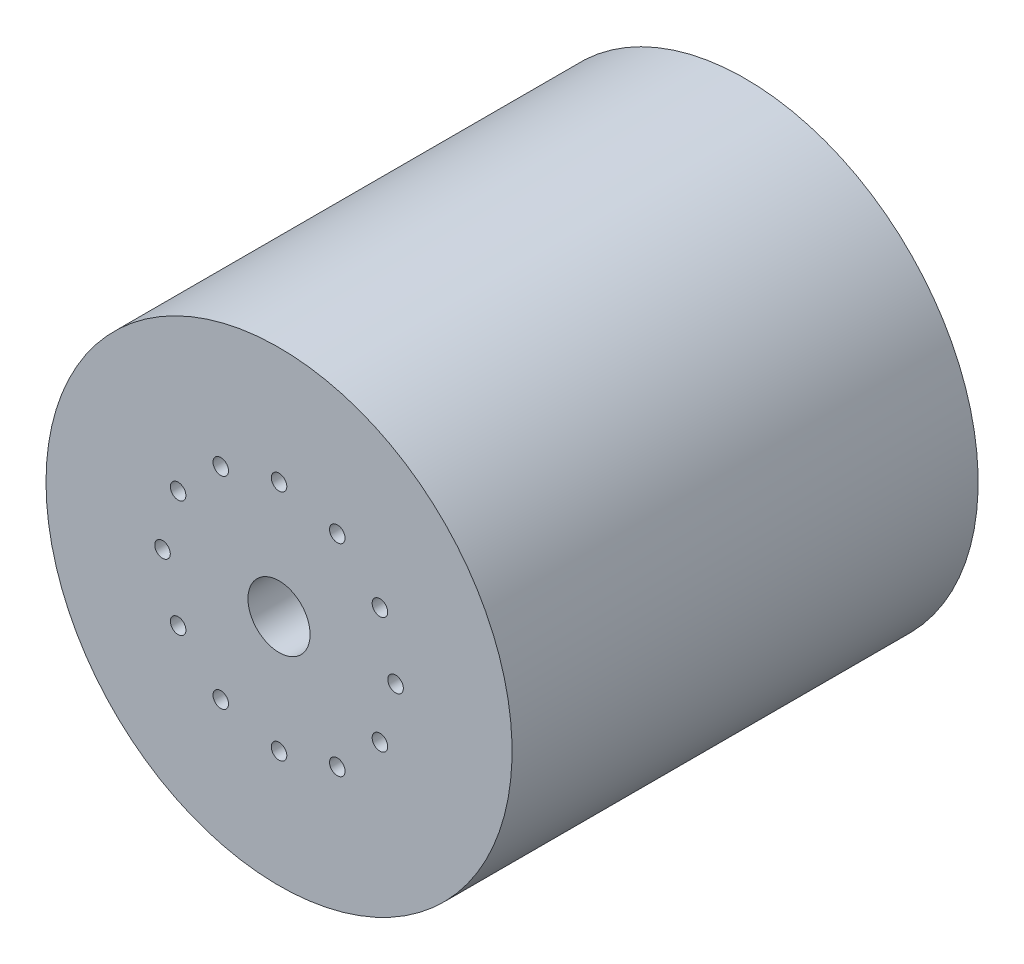
from build123d import *

# Parameters (mm, degrees)
SKETCH1_R           = 38.1
SKETCH1_R_2         = 35.56
SKETCH1_R_3         = 1.27
SKETCH1_R_4         = 7.62
SKETCH1_R_5         = 5.08
BOSS_EXTRUDE1_DEPTH = 76.2
SKETCH3_R           = 35.56
SKETCH3_R_2         = 7.62
SKETCH3_R_3         = 1.27
CUT_EXTRUDE1_DEPTH  = 73.66
SCALE3_SCALE        = 29
SCALE4_SCALE        = 0.95


with BuildPart() as part:
    # Sketch1 → Boss-Extrude1 (new body)
    # profile 1 of 3: a face of its own
    with BuildSketch(Plane.XY):
        with Locations(Location((0, 0, 0), (0, 0, 180))):
            Circle(SKETCH1_R)
        Circle(SKETCH1_R_2, mode=Mode.SUBTRACT)
    # profile 2 of 3: a face of its own
    with BuildSketch(Plane.XY):
        Circle(SKETCH1_R_2)
        with Locations(Location((-9.525, 16.497783942, 0), (0, 0, 180))):
            Circle(SKETCH1_R_3, mode=Mode.SUBTRACT)
        with Locations(Location((-16.497783942, 9.525, 0), (0, 0, 180))):
            Circle(SKETCH1_R_3, mode=Mode.SUBTRACT)
        with Locations(Location((-19.05, 0, 0), (0, 0, 180))):
            Circle(SKETCH1_R_3, mode=Mode.SUBTRACT)
        with Locations(Location((-16.497783942, -9.525, 0), (0, 0, 180))):
            Circle(SKETCH1_R_3, mode=Mode.SUBTRACT)
        with Locations(Location((-9.525, -16.497783942, 0), (0, 0, 180))):
            Circle(SKETCH1_R_3, mode=Mode.SUBTRACT)
        with Locations(Location((0, -19.05, 0), (0, 0, 180))):
            Circle(SKETCH1_R_3, mode=Mode.SUBTRACT)
        with Locations(Location((9.525, -16.497783942, 0), (0, 0, 180))):
            Circle(SKETCH1_R_3, mode=Mode.SUBTRACT)
        with Locations(Location((16.497783942, -9.525, 0), (0, 0, 180))):
            Circle(SKETCH1_R_3, mode=Mode.SUBTRACT)
        with Locations(Location((19.05, 0, 0), (0, 0, 180))):
            Circle(SKETCH1_R_3, mode=Mode.SUBTRACT)
        with Locations(Location((16.497783942, 9.525, 0), (0, 0, 180))):
            Circle(SKETCH1_R_3, mode=Mode.SUBTRACT)
        with Locations(Location((9.525, 16.497783942, 0), (0, 0, 180))):
            Circle(SKETCH1_R_3, mode=Mode.SUBTRACT)
        with Locations(Location((0, 19.05, 0), (0, 0, 180))):
            Circle(SKETCH1_R_3, mode=Mode.SUBTRACT)
        Circle(SKETCH1_R_4, mode=Mode.SUBTRACT)
    # profile 3 of 3: a face of its own
    with BuildSketch(Plane.XY):
        Circle(SKETCH1_R_4)
        with Locations(Location((0, 0, 0), (0, 0, 180))):
            Circle(SKETCH1_R_5, mode=Mode.SUBTRACT)
    extrude(amount=BOSS_EXTRUDE1_DEPTH)

    # Sketch3 → Cut-Extrude1 (cut)
    with BuildSketch(Plane(origin=(0, 0, 0), x_dir=(-1, 0, 0), z_dir=(0, 0, -1))):
        Circle(SKETCH3_R)
        Circle(SKETCH3_R_2, mode=Mode.SUBTRACT)
        with Locations((16.497783942, 9.525)):
            Circle(SKETCH3_R_3, mode=Mode.SUBTRACT)
        with Locations((16.497783942, -9.525)):
            Circle(SKETCH3_R_3, mode=Mode.SUBTRACT)
        with Locations((0, -19.05)):
            Circle(SKETCH3_R_3, mode=Mode.SUBTRACT)
        with Locations((-16.497783942, -9.525)):
            Circle(SKETCH3_R_3, mode=Mode.SUBTRACT)
        with Locations((-16.497783942, 9.525)):
            Circle(SKETCH3_R_3, mode=Mode.SUBTRACT)
        with Locations((0, 19.05)):
            Circle(SKETCH3_R_3, mode=Mode.SUBTRACT)
        with Locations((-9.525, 16.497783942)):
            Circle(SKETCH3_R_3, mode=Mode.SUBTRACT)
        with Locations((-19.05, 0)):
            Circle(SKETCH3_R_3, mode=Mode.SUBTRACT)
        with Locations((-9.525, -16.497783942)):
            Circle(SKETCH3_R_3, mode=Mode.SUBTRACT)
        with Locations((9.525, -16.497783942)):
            Circle(SKETCH3_R_3, mode=Mode.SUBTRACT)
        with Locations((19.05, 0)):
            Circle(SKETCH3_R_3, mode=Mode.SUBTRACT)
        with Locations((9.525, 16.497783942)):
            Circle(SKETCH3_R_3, mode=Mode.SUBTRACT)
    extrude(amount=-CUT_EXTRUDE1_DEPTH, mode=Mode.SUBTRACT)


with BuildPart() as part_1:
    # Scale3: scaled about (0, 0, 43.728504983)
    add(part.part.scale(SCALE3_SCALE).moved(Location((0, 0, -1224.398139524))))


with BuildPart() as part_2:
    # Scale4: scaled about (0, 0, 43.728504994)
    add(part_1.part.scale(SCALE4_SCALE).moved(Location((0, 0, 2.18642525))))


solid = part_2.part
